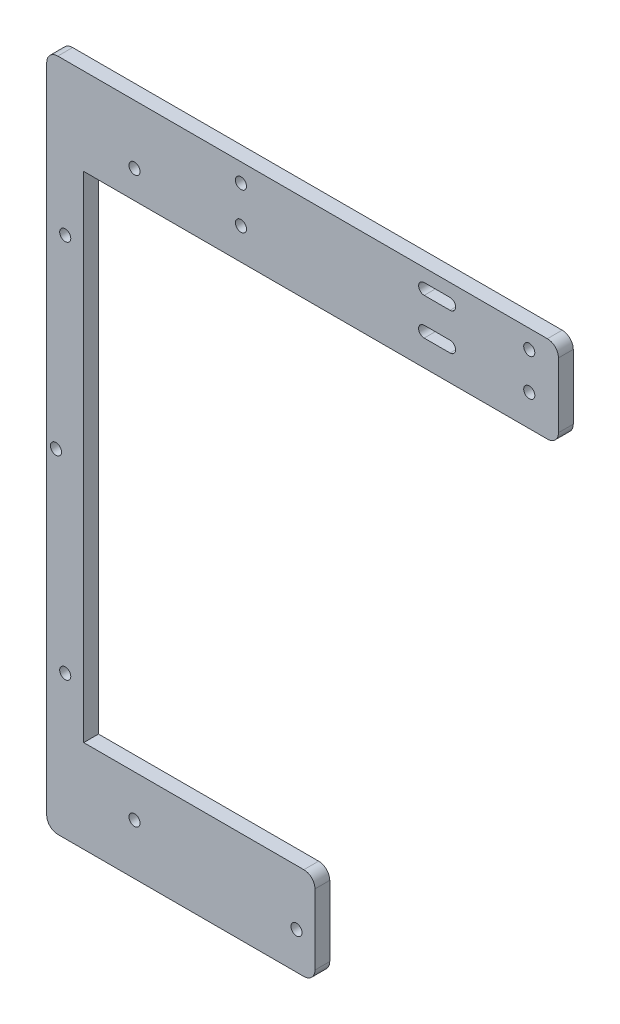
from build123d import *

# Parameters (mm, degrees)
SKETCH_2_R      = 1.5
EXTRUDE_3_DEPTH = 4
FILLET_1_R      = 3


with BuildPart() as part:
    # 草图2 → 凸台-拉伸3 (new body)
    with BuildSketch(Plane.XY):
        Polygon((-83.375314497, 134.732138716), (-83.375314497, -47.467861284), (-10.875314497, -47.467861284), (-10.875314497, -22.467861284), (-73.375314497, -22.467861284), (-73.375314497, 111.232138716), (54.944685503, 111.232138716), (54.944685503, 134.732138716), align=None)
        with Locations((-59.645314497, -33.737861284)):
            Circle(SKETCH_2_R, mode=Mode.SUBTRACT)
        with Locations((-15.875314497, -37.467861284)):
            Circle(SKETCH_2_R, mode=Mode.SUBTRACT)
        with Locations((-78.375314497, -8.737861284)):
            Circle(SKETCH_2_R, mode=Mode.SUBTRACT)
        with Locations((-80.875314497, 42.532138716)):
            Circle(SKETCH_2_R, mode=Mode.SUBTRACT)
        with Locations((-78.375314497, 93.802138716)):
            Circle(SKETCH_2_R, mode=Mode.SUBTRACT)
        with Locations((-59.645314497, 118.802138716)):
            Circle(SKETCH_2_R, mode=Mode.SUBTRACT)
        with Locations((-30.875314497, 119.732138716)):
            Circle(SKETCH_2_R, mode=Mode.SUBTRACT)
        with Locations((-30.875314497, 129.732138716)):
            Circle(SKETCH_2_R, mode=Mode.SUBTRACT)
        with BuildLine():
            ThreePointArc((25.644685503, 131.232138716), (27.144685503, 129.732138716), (25.644685503, 128.232138716))
            Line((25.644685503, 128.232138716), (18.644685503, 128.232138716))
            ThreePointArc((18.644685503, 128.232138716), (17.144685503, 129.732138716), (18.644685503, 131.232138716))
            Line((18.644685503, 131.232138716), (25.644685503, 131.232138716))
        make_face(mode=Mode.SUBTRACT)
        with BuildLine():
            Line((25.644685503, 118.232138716), (18.644685503, 118.232138716))
            ThreePointArc((18.644685503, 118.232138716), (17.144685503, 119.732138716), (18.644685503, 121.232138716))
            Line((18.644685503, 121.232138716), (25.644685503, 121.232138716))
            ThreePointArc((25.644685503, 121.232138716), (27.144685503, 119.732138716), (25.644685503, 118.232138716))
        make_face(mode=Mode.SUBTRACT)
        with Locations((47.044685503, 129.732138716)):
            Circle(SKETCH_2_R, mode=Mode.SUBTRACT)
        with Locations((47.044685503, 119.732138716)):
            Circle(SKETCH_2_R, mode=Mode.SUBTRACT)
    extrude(amount=EXTRUDE_3_DEPTH)

    # 圆角1
    fillet_1_edges = [part.edges().sort_by_distance(p)[0] for p in [
        (-10.875314497, -22.467861284, 2),
        (-10.875314497, -47.467861284, 2),
        (-83.375314497, -47.467861284, 2),
        (-83.375314497, 134.732138716, 2),
        (54.944685503, 134.732138716, 2),
        (54.944685503, 111.232138716, 2),
    ]]
    fillet(fillet_1_edges, radius=FILLET_1_R)


solid = part.part
